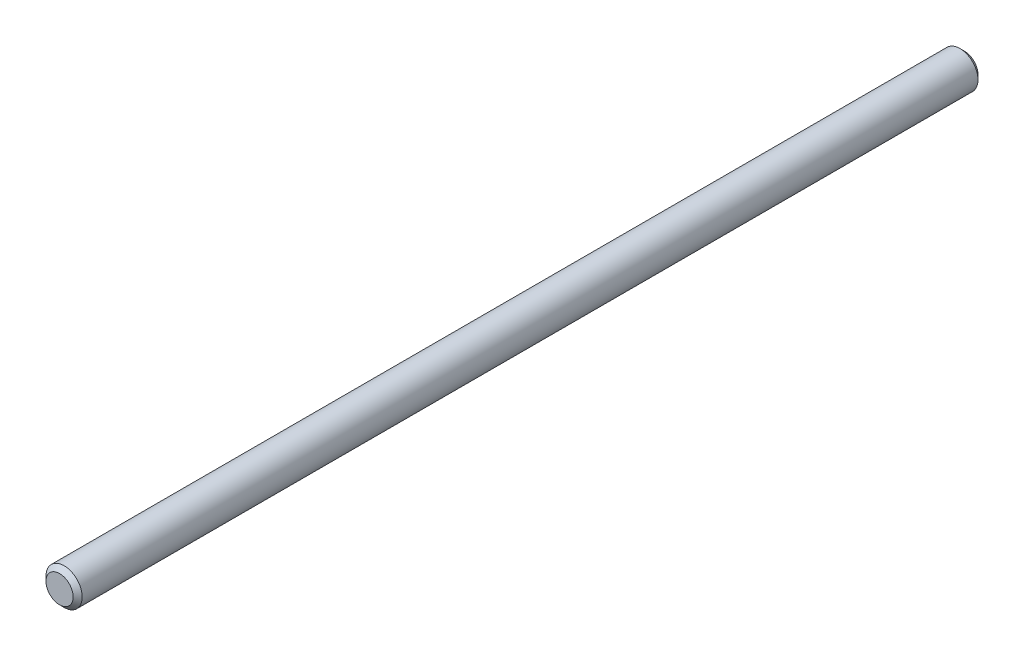
from build123d import *

# Parameters (mm, degrees)
SKETCH1_R         = 4
BODY_DEPTH        = 200
END_CHAMFERS_SIZE = 1


with BuildPart() as part:
    # Sketch1 → body (new body)
    with BuildSketch(Plane.XY):
        Circle(SKETCH1_R)
    extrude(amount=BODY_DEPTH)

    # end_chamfers
    end_chamfers_edges = [part.edges().sort_by_distance(p)[0] for p in [
        (-4, 0, 0),
        (-4, 0, 200),
    ]]
    chamfer(end_chamfers_edges, length=END_CHAMFERS_SIZE)


solid = part.part
